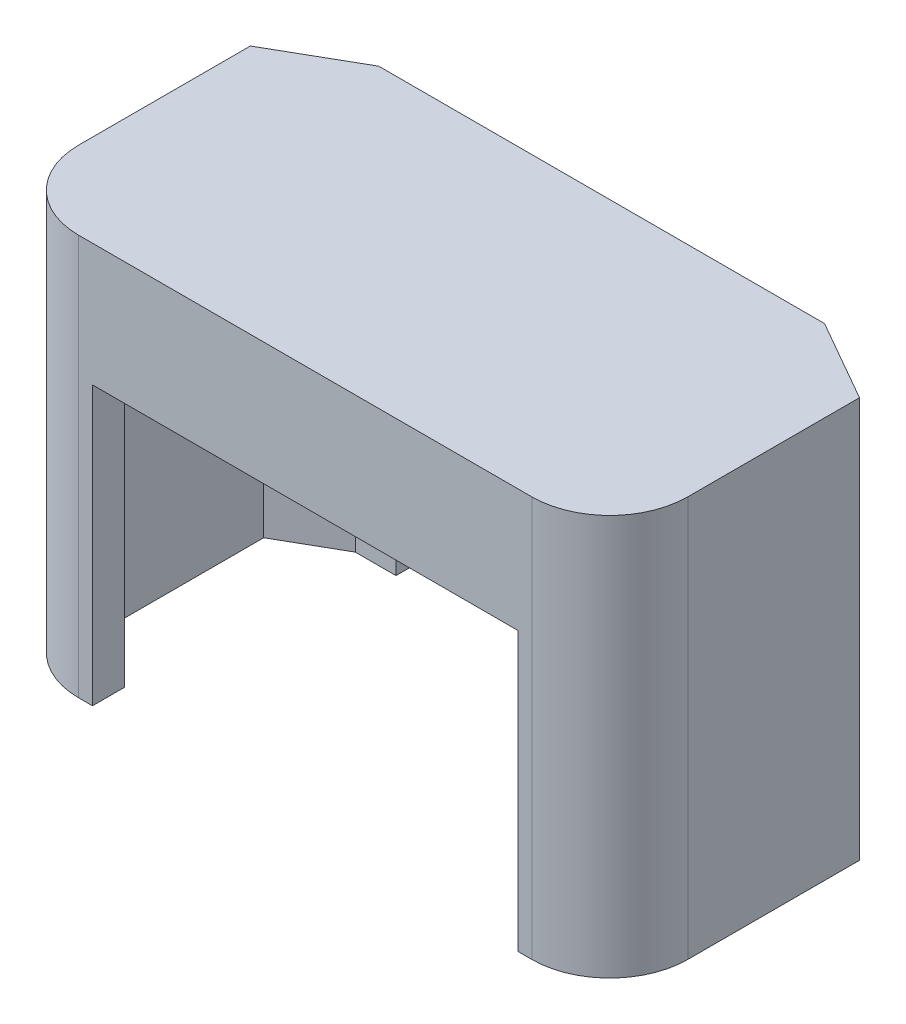
from build123d import *

# Parameters (mm, degrees)
BOSS_EXTRUDE1_DEPTH = 52
BOSS_EXTRUDE2_DEPTH = 4.5
CUT_EXTRUDE1_REACH  = 84.366
SKETCH3_W           = 60
SKETCH3_H           = 39.2
CUT_EXTRUDE2_REACH  = 84.366
SKETCH4_W           = 49
SKETCH4_H           = 12


with BuildPart() as part:
    # Sketch1 → Boss-Extrude1 (new body)
    with BuildSketch(Plane(origin=(0, 0, 0), x_dir=(1, 0, 0), z_dir=(0, 1, 0))):
        with BuildLine():
            Line((-42.95, -9.9), (-42.95, 14.309085823))
            Line((-42.95, 14.309085823), (-31.436935022, 20.9))
            Line((-31.436935022, 20.9), (31.436935022, 20.9))
            Line((31.436935022, 20.9), (42.95, 14.309085823))
            Line((42.95, 14.309085823), (42.95, -9.9))
            ThreePointArc((42.95, -9.9), (39.728174593, -17.678174593), (31.95, -20.9))
            Line((31.95, -20.9), (-31.95, -20.9))
            ThreePointArc((-31.95, -20.9), (-39.728174593, -17.678174593), (-42.95, -9.9))
        make_face()
        with BuildLine():
            Line((-38.45, 11.7), (-30.24, 16.4))
            Line((-30.24, 16.4), (30.24, 16.4))
            Line((30.24, 16.4), (38.45, 11.7))
            Line((38.45, 11.7), (38.45, -9.9))
            ThreePointArc((38.45, -9.9), (36.546194078, -14.496194078), (31.95, -16.4))
            Line((31.95, -16.4), (-31.95, -16.4))
            ThreePointArc((-31.95, -16.4), (-36.546194078, -14.496194078), (-38.45, -9.9))
            Line((-38.45, -9.9), (-38.45, 11.7))
        make_face(mode=Mode.SUBTRACT)
    extrude(amount=BOSS_EXTRUDE1_DEPTH)

    # Sketch2 → Boss-Extrude2 (add)
    with BuildSketch(Plane(origin=(0, 52, 0), x_dir=(1, 0, 0), z_dir=(0, 1, 0))):
        with BuildLine():
            Line((-31.95, -20.9), (31.95, -20.9))
            ThreePointArc((31.95, -20.9), (39.728174593, -17.678174593), (42.95, -9.9))
            Line((42.95, -9.9), (42.95, 14.309085823))
            Line((42.95, 14.309085823), (31.436935022, 20.9))
            Line((31.436935022, 20.9), (-31.436935022, 20.9))
            Line((-31.436935022, 20.9), (-42.95, 14.309085823))
            Line((-42.95, 14.309085823), (-42.95, -9.9))
            ThreePointArc((-42.95, -9.9), (-39.728174593, -17.678174593), (-31.95, -20.9))
        make_face()
    extrude(amount=BOSS_EXTRUDE2_DEPTH)

    # Sketch3 → Cut-Extrude1 (cut, up to next)
    with BuildSketch(Plane.XY.offset(20.9), mode=Mode.PRIVATE) as cut_extrude1_sk1:
        with Locations((0, 19.6)):
            Rectangle(SKETCH3_W, SKETCH3_H)
    cut_extrude1_tool1 = extrude(cut_extrude1_sk1.sketch, amount=-CUT_EXTRUDE1_REACH, mode=Mode.PRIVATE) & part.part
    add(cut_extrude1_tool1.solids().sort_by_distance((0, 19.6, 20.9))[0], mode=Mode.SUBTRACT)

    # Sketch4 → Cut-Extrude2 (cut, up to next)
    with BuildSketch(Plane(origin=(0, 0, -20.9), x_dir=(-1, 0, 0), z_dir=(0, 0, -1)), mode=Mode.PRIVATE) as cut_extrude2_sk1:
        with Locations((0, 6)):
            Rectangle(SKETCH4_W, SKETCH4_H)
    cut_extrude2_tool1 = extrude(cut_extrude2_sk1.sketch, amount=-CUT_EXTRUDE2_REACH, mode=Mode.PRIVATE) & part.part
    add(cut_extrude2_tool1.solids().sort_by_distance((0, 6, -20.9))[0], mode=Mode.SUBTRACT)


solid = part.part
